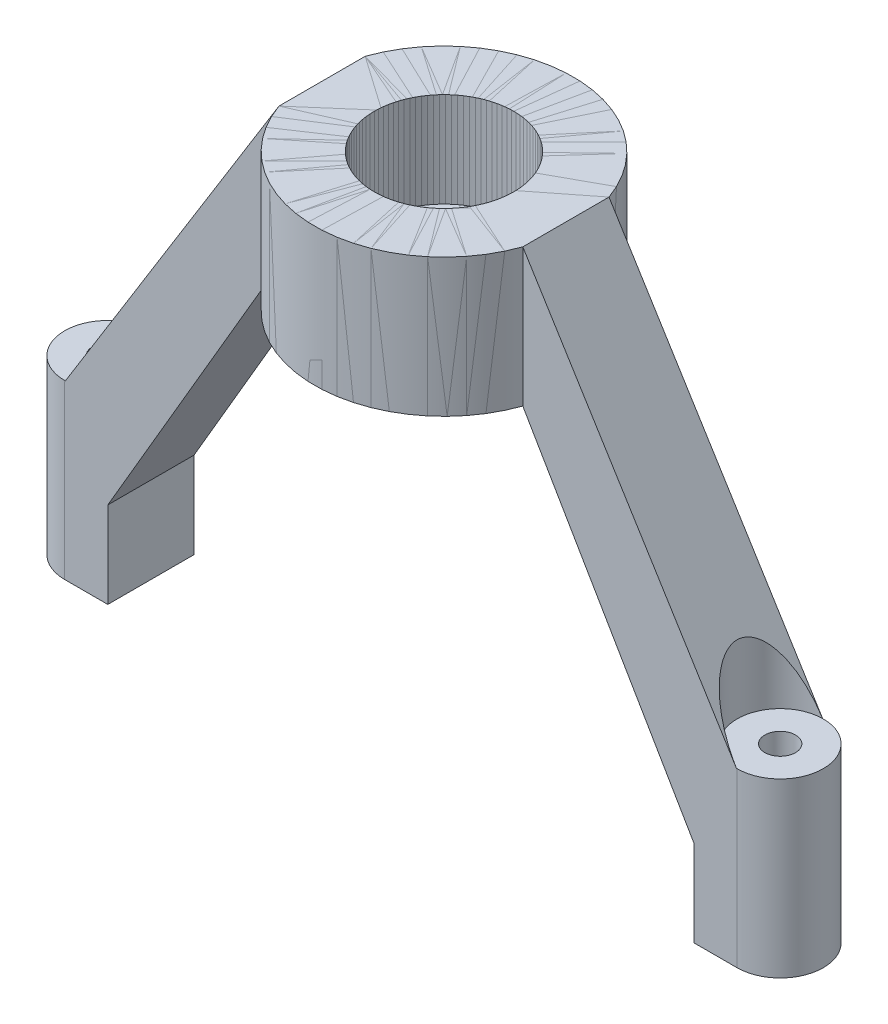
from build123d import *
from build123d.topology import SkipClean

# Parameters (mm, degrees)
SKETCH1_R                = 1.875
BOSS_EXTRUDE1_DEPTH      = 8
BOSS_EXTRUDE2_START      = -17
SKETCH1_3_R              = 2.5
SKETCH1_3_R_2            = 0.889
BOSS_EXTRUDE2_DEPTH      = 5
SKETCH4_R                = 4.05
CUT_EXTRUDE1_DEPTH       = 5.5
BOSS_EXTRUDE3_DEPTH      = 2.5
BOSS_EXTRUDE3_DEPTH_BACK = 2.5
SKETCH5_R                = 2.5
CUT_EXTRUDE2_DEPTH       = 31.663496213
CUT_EXTRUDE3_DEPTH       = 31.663496213
BOSS_EXTRUDE4_START      = 5
SKETCH8_R                = 0.889
BOSS_EXTRUDE4_DEPTH      = 5
CIRPATTERN5_COUNT        = 2


with BuildPart() as part:
    # Sketch1 → Boss-Extrude1 (new body)
    with BuildSketch(Plane(origin=(0, 0, 0), x_dir=(1, 0, 0), z_dir=(0, 1, 0))):
        with BuildLine():
            Line((7.071067812, -2.5), (7.071067812, 2.5))
            ThreePointArc((7.071067812, 2.5), (0, 7.5), (-7.071067812, 2.5))
            Line((-7.071067812, 2.5), (-7.071067812, -2.5))
            ThreePointArc((-7.071067812, -2.5), (0, -7.5), (7.071067812, -2.5))
        make_face()
        Circle(SKETCH1_R, mode=Mode.SUBTRACT)
    extrude(amount=BOSS_EXTRUDE1_DEPTH)

    # Sketch4 → Cut-Extrude1 (cut)
    with BuildSketch(Plane(origin=(0, 8, 0), x_dir=(1, 0, 0), z_dir=(0, 1, 0))):
        Circle(SKETCH4_R)
    extrude(amount=-CUT_EXTRUDE1_DEPTH, mode=Mode.SUBTRACT)



with BuildPart() as body_2:
    # Sketch1<3> → Boss-Extrude2 (new body)
    with BuildSketch(Plane(origin=(0, 0, 0), x_dir=(1, 0, 0), z_dir=(0, 1, 0)).offset(BOSS_EXTRUDE2_START)):
        with Locations((-19.5, 0)):
            Circle(SKETCH1_3_R)
        with Locations((-19.5, 0)):
            Circle(SKETCH1_3_R_2, mode=Mode.SUBTRACT)
    extrude(amount=BOSS_EXTRUDE2_DEPTH)


with BuildPart() as part_1:
    add(part.part)

    add(body_2.part)  # Boss-Extrude3 merges body 2
    # Sketch3 → Boss-Extrude3 (add, two sides: drawn at the far end of the back side and taken through both)
    with BuildSketch(Plane.XY.offset(-BOSS_EXTRUDE3_DEPTH_BACK)):
        Polygon((-7.071067812, 8), (-19.5, -12.060762386), (-19.5, -17), (-17, -17), (-7.071067812, 0), align=None)
    extrude(amount=BOSS_EXTRUDE3_DEPTH + BOSS_EXTRUDE3_DEPTH_BACK)

    # Sketch5 → Cut-Extrude2 (cut, through all)
    with BuildSketch(Plane(origin=(0, -12, 0), x_dir=(1, 0, 0), z_dir=(0, 1, 0))):
        with Locations((-19.5, 0)):
            Circle(SKETCH5_R)
    extrude(amount=CUT_EXTRUDE2_DEPTH, mode=Mode.SUBTRACT)

    # Sketch5<3> → Cut-Extrude3 (cut, through all)
    with BuildSketch(Plane(origin=(0, -12, 0), x_dir=(1, 0, 0), z_dir=(0, 1, 0))):
        with BuildLine():
            ThreePointArc((-19.462353795, -0.888202546), (-18.858210129, -0.615164012), (-18.611, 0))
            ThreePointArc((-18.611, 0), (-18.858210129, 0.615164012), (-19.462353795, 0.888202546))
            ThreePointArc((-19.462353795, 0.888202546), (-20.389, 0), (-19.462353795, -0.888202546))
        make_face()
    extrude(amount=-CUT_EXTRUDE3_DEPTH, mode=Mode.SUBTRACT)

    # Sketch8 → Boss-Extrude4 (add)
    with SkipClean():  # the faces are left unmerged after this step: merging them gives an invalid solid
        with BuildSketch(Plane.XZ.offset(17).offset(BOSS_EXTRUDE4_START)):
            with BuildLine():
                Line((-19.5, -2.5), (-17, -2.5))
                Line((-17, -2.5), (-17, 2.5))
                Line((-17, 2.5), (-19.5, 2.5))
                ThreePointArc((-19.5, 2.5), (-22, 0), (-19.5, -2.5))
            make_face()
            with Locations((-19.5, 0)):
                Circle(SKETCH8_R, mode=Mode.SUBTRACT)
        extrude(amount=-BOSS_EXTRUDE4_DEPTH)


with BuildPart() as cirpattern5_1:
    # CirPattern5: pattern copy
    add(part_1.part.rotate(Axis((0, 8, 0), (0, 1, 0)), 1 * 360 / CIRPATTERN5_COUNT))


solid = Compound([part_1.part, cirpattern5_1.part])
